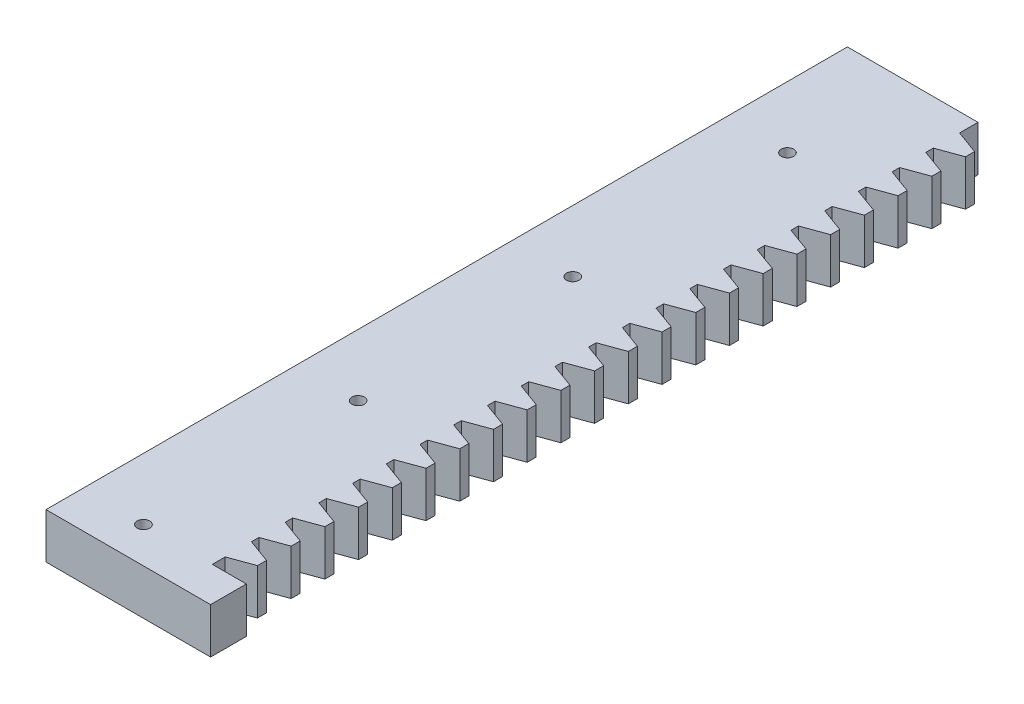
from build123d import *

# Parameters (mm, degrees)
SKETCH1_R           = 0.875
BOSS_EXTRUDE1_DEPTH = 6.35
SKETCH2_R           = 1.35
CUT_EXTRUDE1_DEPTH  = 12


with BuildPart() as part:
    # Sketch1 → Boss-Extrude1 (new body)
    with BuildSketch(Plane(origin=(0, 0, 0), x_dir=(1, 0, 0), z_dir=(0, 1, 0))):
        Polygon((0, 0), (0, 100), (0, 112), (18.25, 112), (18.25, 109.424759036), (21.549993184, 108.223659704), (21.549993186, 106.959378538), (18.25, 105.758279069), (18.25, 104.712379468), (21.549993194, 103.511280133), (21.549993196, 102.246998966), (18.25, 101.045899493), (18.25, 100), (21.549993184, 98.798900669), (21.549993186, 97.534619502), (18.25, 96.333520033), (18.25, 95.287620432), (21.549993194, 94.086521097), (21.549993196, 92.822239931), (18.25, 91.621140458), (18.25, 90.575240964), (21.549993204, 89.374141626), (21.549993207, 88.109860459), (18.25, 86.908760983), (18.25, 85.862861496), (21.549993214, 84.661762154), (21.549993217, 83.397480988), (18.25, 82.196381507), (18.25, 81.150481929), (21.549993224, 79.949382583), (21.549993227, 78.685101416), (18.25, 77.484001932), (18.25, 76.438102461), (21.549993234, 75.237003111), (21.549993237, 73.972721945), (18.25, 72.771622457), (18.25, 71.725722993), (21.549993244, 70.524623639), (21.549993247, 69.260342473), (18.25, 68.059242982), (18.25, 67.013343425), (21.549993254, 65.812244068), (21.549993257, 64.547962902), (18.25, 63.346863406), (18.25, 62.300963957), (21.549993265, 61.099864596), (21.549993267, 59.83558343), (18.25, 58.634483931), (18.25, 57.588584489), (21.549993275, 56.387485125), (21.549993277, 55.123203959), (18.25, 53.922104456), (18.25, 52.876204922), (21.549993285, 51.675105553), (21.549993288, 50.410824387), (18.25, 49.209724881), (18.25, 48.163825454), (21.549993295, 46.962726082), (21.549993298, 45.698444915), (18.25, 44.497345406), (18.25, 43.451445986), (21.549993305, 42.25034661), (21.549993308, 40.986065444), (18.25, 39.78496593), (18.25, 38.739066418), (21.549993315, 37.537967039), (21.549993318, 36.273685872), (18.25, 35.072586355), (18.25, 34.026686847), (21.549993325, 32.825587464), (21.549993328, 31.561306401), (18.25, 30.36020688), (18.25, 29.314307482), (21.549993336, 28.113208096), (21.549993338, 26.848926929), (18.25, 25.647827405), (18.25, 24.601927915), (21.549993346, 23.400828524), (21.549993348, 22.136547358), (18.25, 20.935447829), (18.25, 19.889548447), (21.549993356, 18.688449053), (21.549993359, 17.424167886), (18.25, 16.223068354), (18.25, 15.177168979), (21.549993366, 13.976069581), (21.549993369, 12.711788415), (18.25, 11.510688879), (18.25, 10.464789411), (21.549993376, 9.26369001), (21.549993379, 7.999408843), (18.25, 6.798309304), (18.25, 5), (23, 5), (23, 0), align=None)
        with Locations(Location((8.619246516, 95, 0), (0, 0, 270))):
            Circle(SKETCH1_R, mode=Mode.SUBTRACT)
        with Locations(Location((8.619246516, 65, 0), (0, 0, 270))):
            Circle(SKETCH1_R, mode=Mode.SUBTRACT)
        with Locations(Location((8.619246516, 35, 0), (0, 0, 270))):
            Circle(SKETCH1_R, mode=Mode.SUBTRACT)
        with Locations(Location((8.619246516, 5, 0), (0, 0, 270))):
            Circle(SKETCH1_R, mode=Mode.SUBTRACT)
    extrude(amount=BOSS_EXTRUDE1_DEPTH)

    # Sketch2 → Cut-Extrude1 (cut)
    with BuildSketch(Plane(origin=(0, 0, -112), x_dir=(-1, 0, 0), z_dir=(0, 0, -1))):
        with Locations((-13.625, 3.175)):
            Circle(SKETCH2_R)
        with Locations((-4.625, 3.175)):
            Circle(SKETCH2_R)
    extrude(amount=-CUT_EXTRUDE1_DEPTH, mode=Mode.SUBTRACT)


solid = part.part
